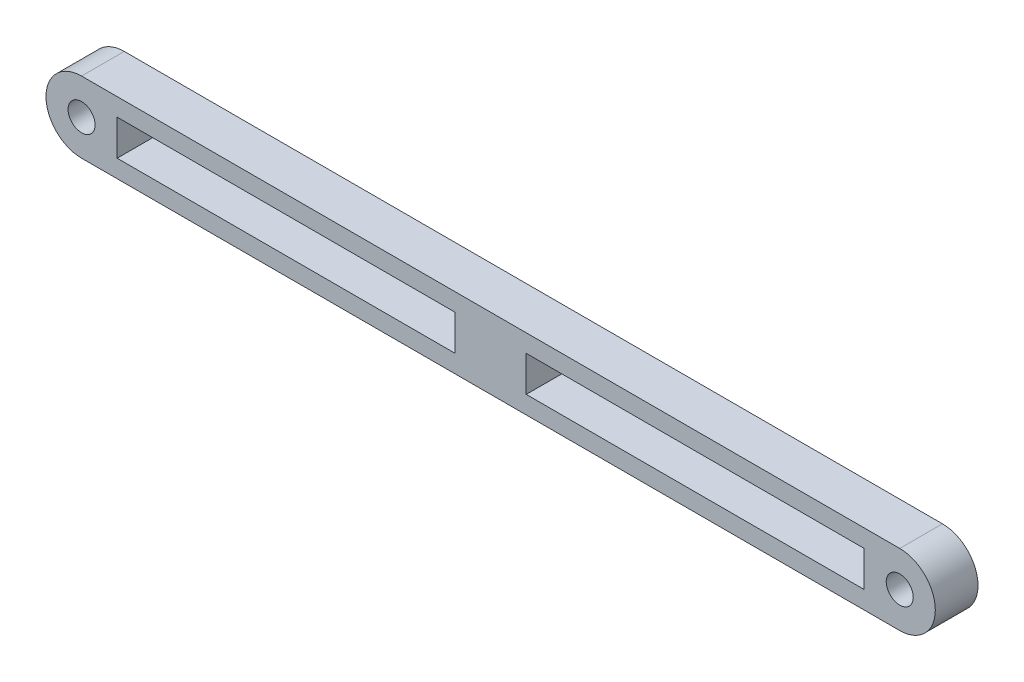
from build123d import *

# Parameters (mm, degrees)
SKETCH1_R           = 1.9
BOSS_EXTRUDE1_DEPTH = 6
SKETCH2_W           = 47.5
SKETCH2_H           = 5
CUT_EXTRUDE1_DEPTH  = 63.98610958


with BuildPart() as part:
    # Sketch1 → Boss-Extrude1 (new body)
    with BuildSketch(Plane.XY):
        with BuildLine():
            Line((-57.5, 5), (57.5, 5))
            ThreePointArc((57.5, 5), (62.5, 0), (57.5, -5))
            Line((57.5, -5), (-57.5, -5))
            ThreePointArc((-57.5, -5), (-62.5, 0), (-57.5, 5))
        make_face()
        with Locations((-57.5, 0)):
            Circle(SKETCH1_R, mode=Mode.SUBTRACT)
        with Locations((57.5, 0)):
            Circle(SKETCH1_R, mode=Mode.SUBTRACT)
    extrude(amount=BOSS_EXTRUDE1_DEPTH)

    # Sketch2 → Cut-Extrude1 (cut, through all)
    with BuildSketch(Plane.XY.offset(6)):
        with Locations((-28.75, 0)):
            Rectangle(SKETCH2_W, SKETCH2_H)
        with Locations((28.75, 0)):
            Rectangle(SKETCH2_W, SKETCH2_H)
    extrude(amount=-CUT_EXTRUDE1_DEPTH, mode=Mode.SUBTRACT)


solid = part.part
